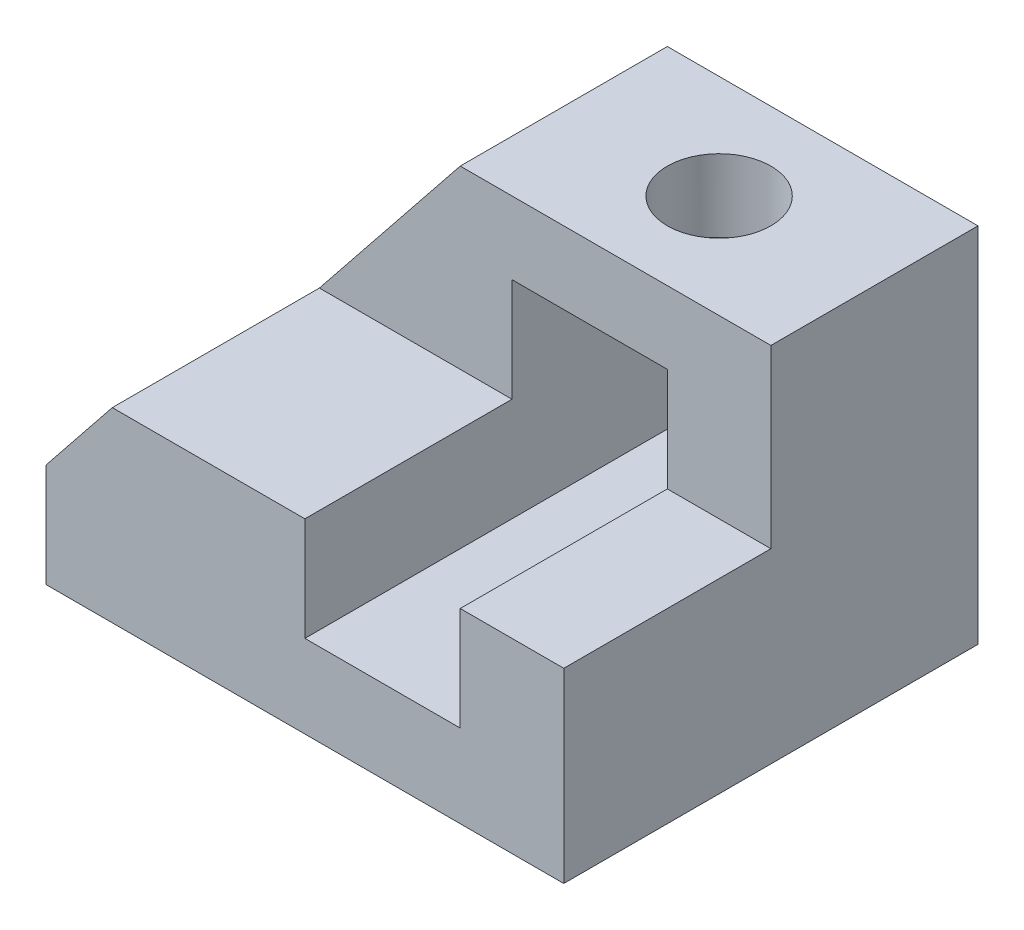
from build123d import *

# Parameters (mm, degrees)
BOSS_EXTRUDE1_DEPTH = 40
BOSS_EXTRUDE2_DEPTH = 20
SKETCH4_R           = 5
CUT_EXTRUDE3_DEPTH  = 20


with BuildPart() as part:
    # Sketch2 → Boss-Extrude1 (new body)
    with BuildSketch(Plane.XY):
        Polygon((0, 10), (0, 0), (50, 0), (50, 18), (40, 18), (40, 8), (25, 8), (25, 18), (6.4, 18), align=None)
    extrude(amount=BOSS_EXTRUDE1_DEPTH)

    # Sketch2<4> → Boss-Extrude2 (add)
    with BuildSketch(Plane.XY):
        Polygon((20, 35), (6.4, 18), (25, 18), (25, 28), (40, 28), (40, 18), (50, 18), (50, 35), align=None)
    extrude(amount=BOSS_EXTRUDE2_DEPTH)

    # Sketch4 → Cut-Extrude3 (cut)
    with BuildSketch(Plane(origin=(0, 35, 0), x_dir=(1, 0, 0), z_dir=(0, 1, 0))):
        with Locations(Location((35, -10, 0), (0, 0, 270))):
            Circle(SKETCH4_R)
    extrude(amount=-CUT_EXTRUDE3_DEPTH, mode=Mode.SUBTRACT)


solid = part.part
